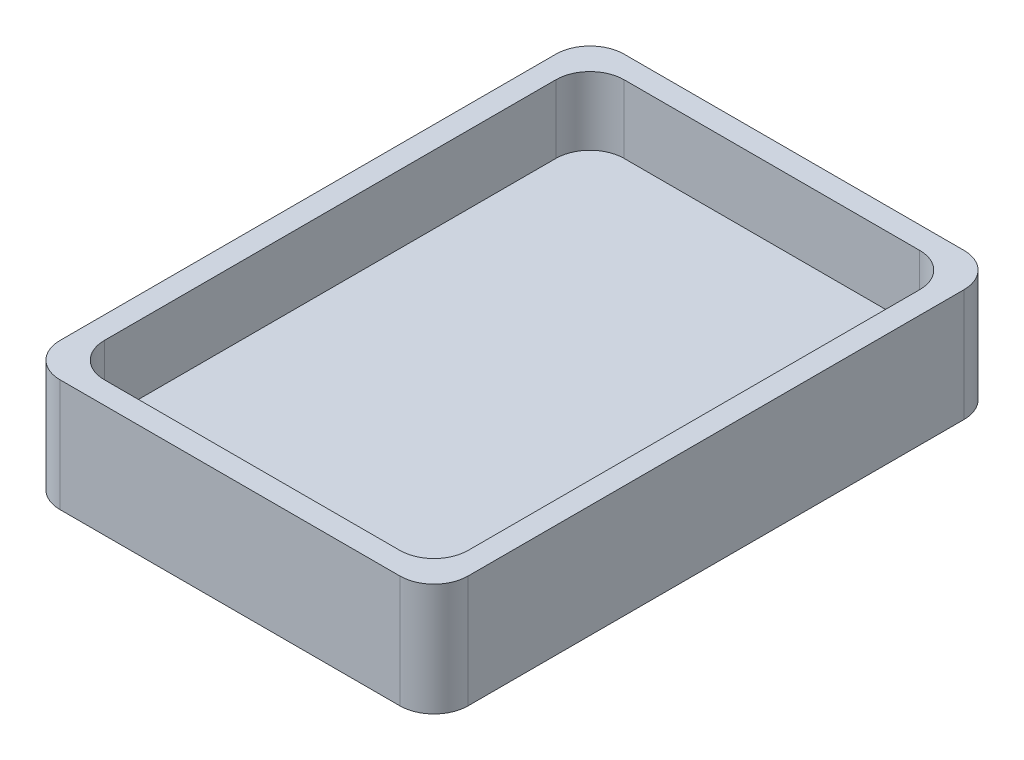
from build123d import *

# Parameters (mm, degrees)
SALIENTE_EXTRUIR1_DEPTH = 4
SALIENTE_EXTRUIR2_START = 2.6
SALIENTE_EXTRUIR2_DEPTH = 2.6
CROQUIS4_W              = 0.550354004
CROQUIS4_H              = 1.651062012
CORTAR_EXTRUIR2_DEPTH   = 1.3


with BuildPart() as part:
    # Croquis1 → Saliente-Extruir1 (new body)
    with BuildSketch(Plane(origin=(0, 0, 0), x_dir=(1, 0, 0), z_dir=(0, 1, 0))):
        with BuildLine():
            Line((-8.295775691, 15.129732152), (11.650012909, 15.129732152))
            ThreePointArc((11.650012909, 15.129732152), (13.064226472, 14.543945715), (13.650012909, 13.129732152))
            Line((13.650012909, 13.129732152), (13.650012909, -15.970267848))
            ThreePointArc((13.650012909, -15.970267848), (13.064226472, -17.38448141), (11.650012909, -17.970267848))
            Line((11.650012909, -17.970267848), (-8.295775691, -17.970267848))
            ThreePointArc((-8.295775691, -17.970267848), (-9.709989253, -17.38448141), (-10.295775691, -15.970267848))
            Line((-10.295775691, -15.970267848), (-10.295775691, 13.129732152))
            ThreePointArc((-10.295775691, 13.129732152), (-9.709989253, 14.543945715), (-8.295775691, 15.129732152))
        make_face()
        with BuildLine():
            Line((-6.995775691, 13.829732152), (10.350012909, 13.829732152))
            ThreePointArc((10.350012909, 13.829732152), (11.764226472, 13.243945715), (12.350012909, 11.829732152))
            Line((12.350012909, 11.829732152), (12.350012909, -14.670267848))
            ThreePointArc((12.350012909, -14.670267848), (11.764226472, -16.08448141), (10.350012909, -16.670267848))
            Line((10.350012909, -16.670267848), (-6.995775691, -16.670267848))
            ThreePointArc((-6.995775691, -16.670267848), (-8.409989253, -16.08448141), (-8.995775691, -14.670267848))
            Line((-8.995775691, -14.670267848), (-8.995775691, 11.829732152))
            ThreePointArc((-8.995775691, 11.829732152), (-8.409989253, 13.243945715), (-6.995775691, 13.829732152))
        make_face(mode=Mode.SUBTRACT)
    extrude(amount=SALIENTE_EXTRUIR1_DEPTH)

    # Croquis2 → Saliente-Extruir2 (add)
    with BuildSketch(Plane.XZ.offset(SALIENTE_EXTRUIR2_START)):
        with BuildLine():
            Line((-8.295775691, -15.129732152), (11.650012909, -15.129732152))
            ThreePointArc((11.650012909, -15.129732152), (13.064226472, -14.543945715), (13.650012909, -13.129732152))
            Line((13.650012909, -13.129732152), (13.650012909, 15.970267848))
            ThreePointArc((13.650012909, 15.970267848), (13.064226472, 17.38448141), (11.650012909, 17.970267848))
            Line((11.650012909, 17.970267848), (-8.295775691, 17.970267848))
            ThreePointArc((-8.295775691, 17.970267848), (-9.709989253, 17.38448141), (-10.295775691, 15.970267848))
            Line((-10.295775691, 15.970267848), (-10.295775691, -13.129732152))
            ThreePointArc((-10.295775691, -13.129732152), (-9.709989253, -14.543945715), (-8.295775691, -15.129732152))
        make_face()
    extrude(amount=-SALIENTE_EXTRUIR2_DEPTH)

    # Croquis4 → Cortar-Extruir2 (cut)
    # profile 1 of 6: a face of its own
    with BuildSketch(Plane.XZ.offset(2.6)):
        with BuildLine():
            Line((3.878534641, 9.583852239), (-0.340846056, 12.485631944))
            Line((-0.340846056, 12.485631944), (-0.340846056, 10.628187181))
            add(Edge.make_bspline(
                [(-0.340846056, 10.628187181), (-0.340293861, 10.593775491), (-0.339218325, 10.526750183), (-0.330985944, 10.429595771), (-0.315516971, 10.338925542), (-0.294432344, 10.255029258), (-0.269213104, 10.176854825), (-0.236354049, 10.10543452), (-0.197376818, 10.040848055), (-0.152224109, 9.981246937), (-0.097250421, 9.92664647), (-0.030422822, 9.875622341), (0.047331434, 9.824248611), (0.138354394, 9.776893843), (0.240158527, 9.728163886), (0.354743886, 9.68318014), (0.48134522, 9.639076545), (0.570252198, 9.612185098), (0.616540597, 9.598184375)],
                knots=[0, 0, 0, 0, 1.061955357, 2.06842165, 3.00564852, 3.8972323, 4.736458012, 5.536913666, 6.317386089, 7.060509816, 7.838937086, 8.700150504, 9.651597968, 10.711413248, 11.86339383, 13.133749289, 14.507719437, 16, 16, 16, 16], degree=3))
            Line((0.616540597, 9.598184375), (0.596475607, 9.492126572))
            Line((0.596475607, 9.492126572), (-0.524297391, 9.695642896))
            Line((-0.524297391, 9.695642896), (-0.524297391, 13.283454154))
            Line((-0.524297391, 13.283454154), (-0.441171005, 13.283454154))
            Line((-0.441171005, 13.283454154), (3.695083306, 10.439958467))
            Line((3.695083306, 10.439958467), (3.695083306, 11.83973037))
            add(Edge.make_bspline(
                [(3.695083306, 11.83973037), (3.69436279, 11.893921517), (3.693024703, 11.994561104), (3.678683069, 12.133200846), (3.657806852, 12.248677769), (3.623521604, 12.342017743), (3.579488543, 12.418106582), (3.52919239, 12.484007315), (3.46840076, 12.538876732), (3.411353317, 12.578418915), (3.358000775, 12.604289013), (3.310811044, 12.624935719), (3.255226373, 12.643296392), (3.191885132, 12.662610035), (3.120822557, 12.681436978), (3.041837671, 12.699789458), (2.955030198, 12.716562722), (2.894407357, 12.727440306), (2.86286397, 12.73310015)],
                knots=[0, 0, 0, 0, 1.853494271, 3.442165503, 4.765163255, 5.858301625, 6.82480623, 7.764392432, 8.68223785, 9.616245567, 10.127996757, 10.708984006, 11.377604019, 12.12918449, 12.975111885, 13.892439551, 14.903390307, 16, 16, 16, 16], degree=3))
            Line((2.86286397, 12.73310015), (2.86286397, 12.85540104))
            Line((2.86286397, 12.85540104), (3.878534641, 12.73310015))
            Line((3.878534641, 12.73310015), (3.878534641, 9.583852239))
        make_face()
    # profile 2 of 6: a face of its own
    with BuildSketch(Plane.XZ.offset(2.6)):
        with Locations((0.973888509, 8.238542452)):
            Rectangle(CROQUIS4_W, CROQUIS4_H)
    # profile 3 of 6: a face of its own
    with BuildSketch(Plane.XZ.offset(2.6)):
        with BuildLine():
            Line((3.939685086, 4.110887423), (2.410923964, 4.110887423))
            Line((2.410923964, 4.110887423), (2.410923964, 4.233188312))
            add(Edge.make_bspline(
                [(2.410923964, 4.233188312), (2.484959918, 4.243081359), (2.625815892, 4.261903224), (2.824537189, 4.30325674), (2.999339933, 4.356308559), (3.152761472, 4.420600115), (3.286877616, 4.498868222), (3.404728006, 4.591925382), (3.508899902, 4.698341527), (3.596406149, 4.818758967), (3.666091984, 4.947653567), (3.719236021, 5.07995903), (3.749561882, 5.215648544), (3.75401481, 5.306685612), (3.756233751, 5.352050358)],
                knots=[0, 0, 0, 0, 1.39142573, 2.647235773, 3.777217868, 4.790166756, 5.739721597, 6.660947591, 7.57997301, 8.505774658, 9.424550985, 10.303925409, 11.154827868, 12, 12, 12, 12], degree=3))
            add(Edge.make_bspline(
                [(3.756233751, 5.352050358), (3.755876154, 5.377256381), (3.755171207, 5.426946262), (3.743852355, 5.49944691), (3.727926103, 5.568995783), (3.705005658, 5.635060043), (3.675029575, 5.697767445), (3.638630472, 5.756835458), (3.596201412, 5.81327063), (3.531044553, 5.881060793), (3.442606852, 5.955121808), (3.325240573, 6.020581977), (3.199560112, 6.060927113), (3.112850553, 6.065434845), (3.069246722, 6.067701659)],
                knots=[0, 0, 0, 0, 0.823190787, 1.622796809, 2.393120433, 3.153812862, 3.903666924, 4.660859271, 5.418910275, 6.207043985, 7.730921109, 9.171105095, 10.577427236, 12, 12, 12, 12], degree=3))
            add(Edge.make_bspline(
                [(3.069246722, 6.067701659), (3.03562727, 6.066424365), (2.969408893, 6.063908551), (2.872974217, 6.037895325), (2.780030324, 5.999843847), (2.724651647, 5.961164018), (2.696611198, 5.941578866)],
                knots=[0, 0, 0, 0, 1.005601748, 1.980678245, 2.977536257, 4, 4, 4, 4], degree=3))
            add(Edge.make_bspline(
                [(2.696611198, 5.941578866), (2.674949824, 5.924104807), (2.627853588, 5.886112644), (2.558842003, 5.816135937), (2.482988493, 5.73239534), (2.404480408, 5.631020249), (2.319104685, 5.515277061), (2.228829412, 5.383524134), (2.133241174, 5.236342677), (2.069561828, 5.132133778), (2.036377489, 5.077828832)],
                knots=[0, 0, 0, 0, 0.611101905, 1.328659962, 2.156268474, 3.09294578, 4.144138902, 5.3166236, 6.60164907, 8, 8, 8, 8], degree=3))
            add(Edge.make_bspline(
                [(2.036377489, 5.077828832), (2.00935476, 5.033210067), (1.957147302, 4.947007362), (1.880937874, 4.822968178), (1.809428189, 4.709157688), (1.742172424, 4.606088553), (1.681146875, 4.512161261), (1.625146353, 4.42812719), (1.573459392, 4.354820656), (1.513095561, 4.270810814), (1.437669316, 4.178184385), (1.338037022, 4.081686712), (1.230819956, 3.998195288), (1.116458907, 3.928422776), (0.996705068, 3.873766429), (0.873578266, 3.834453378), (0.747512665, 3.809231844), (0.662201826, 3.806503718), (0.619407024, 3.805135198)],
                knots=[0, 0, 0, 0, 1.248564963, 2.412206562, 3.484516376, 4.465640353, 5.357921181, 6.165592113, 6.882544305, 7.504670364, 8.641790332, 9.736174339, 10.817308786, 11.888072917, 12.935378102, 13.959992044, 14.976663013, 16, 16, 16, 16], degree=3))
            add(Edge.make_bspline(
                [(0.619407024, 3.805135198), (0.578884567, 3.806112801), (0.499009673, 3.808039779), (0.381836812, 3.827030806), (0.269115063, 3.856644683), (0.160598597, 3.898088985), (0.055658703, 3.950845439), (-0.044653033, 4.016225865), (-0.140855623, 4.093127548), (-0.230951403, 4.181627739), (-0.313235316, 4.279345991), (-0.387021406, 4.383907746), (-0.447900021, 4.496498995), (-0.498774486, 4.615051679), (-0.538305506, 4.740487163), (-0.565690993, 4.87268847), (-0.582075735, 5.011806822), (-0.58430851, 5.10676681), (-0.585447835, 5.155222364)],
                knots=[0, 0, 0, 0, 0.963147794, 1.898486258, 2.815390311, 3.731292419, 4.656172952, 5.603823843, 6.573947296, 7.581047086, 8.602405402, 9.609020728, 10.619278069, 11.640833019, 12.673450854, 13.741688496, 14.847643762, 16, 16, 16, 16], degree=3))
            add(Edge.make_bspline(
                [(-0.585447835, 5.155222364), (-0.584142722, 5.215520271), (-0.581600209, 5.332987594), (-0.564907589, 5.449282921), (-0.556783564, 5.505881946)],
                knots=[0, 0, 0, 0, 1.026632861, 2, 2, 2, 2], degree=3))
            add(Edge.make_bspline(
                [(-0.556783564, 5.505881946), (-0.554890775, 5.515121844), (-0.55064092, 5.535868072), (-0.543096173, 5.570371111), (-0.53244132, 5.611439471), (-0.51896141, 5.65878023), (-0.503584422, 5.712990628), (-0.48566664, 5.773581554), (-0.464405836, 5.840714885), (-0.441260938, 5.911986941), (-0.417622817, 5.983008543), (-0.397963493, 6.049805707), (-0.3805685, 6.109306402), (-0.366019368, 6.161415132), (-0.355482514, 6.206744631), (-0.347750656, 6.244959732), (-0.342598065, 6.276188335), (-0.341372056, 6.29477455), (-0.340846056, 6.302748681)],
                knots=[0, 0, 0, 0, 0.54761179, 1.229545953, 2.05028691, 3.010423316, 4.087386644, 5.321895787, 6.678726042, 8.175741249, 9.672756456, 11.024157601, 12.217972098, 13.272151859, 14.164739674, 14.919049308, 15.53623463, 16, 16, 16, 16], degree=3))
            add(Edge.make_bspline(
                [(-0.340846056, 6.302748681), (-0.341364831, 6.31521463), (-0.342362902, 6.339197893), (-0.350920822, 6.373571603), (-0.366478278, 6.403459572), (-0.38853237, 6.430321693), (-0.421445999, 6.451274059), (-0.464523333, 6.470941767), (-0.520951626, 6.484832166), (-0.562793108, 6.491918134), (-0.585447835, 6.495754773)],
                knots=[0, 0, 0, 0, 0.858084681, 1.650870771, 2.416167262, 3.163326943, 4.015220049, 5.07550074, 6.416553863, 8, 8, 8, 8], degree=3))
            Line((-0.585447835, 6.495754773), (-0.585447835, 6.618055663))
            Line((-0.585447835, 6.618055663), (0.943313287, 6.618055663))
            Line((0.943313287, 6.618055663), (0.943313287, 6.495754773))
            add(Edge.make_bspline(
                [(0.943313287, 6.495754773), (0.902174275, 6.489036114), (0.822563997, 6.476034481), (0.707752334, 6.452436739), (0.600603173, 6.429595375), (0.502156825, 6.402097011), (0.411067276, 6.374903579), (0.327839387, 6.345246186), (0.252325489, 6.314147882), (0.16308934, 6.269479761), (0.060122966, 6.204648428), (-0.050853832, 6.108327553), (-0.151028826, 5.993980349), (-0.238987986, 5.864221218), (-0.311440852, 5.722258576), (-0.36333449, 5.571107353), (-0.396206202, 5.413343982), (-0.400051012, 5.305393359), (-0.401996501, 5.250769934)],
                knots=[0, 0, 0, 0, 0.984182084, 1.904542815, 2.767594021, 3.570341986, 4.31735939, 5.011959232, 5.655849932, 6.244440382, 7.36692079, 8.518747489, 9.701680121, 10.946991771, 12.211638285, 13.453174393, 14.711296577, 16, 16, 16, 16], degree=3))
            add(Edge.make_bspline(
                [(-0.401996501, 5.250769934), (-0.401115433, 5.219539095), (-0.39939413, 5.158524784), (-0.390258273, 5.069222978), (-0.372902146, 4.98483715), (-0.348960659, 4.905648845), (-0.319575809, 4.83093368), (-0.281809061, 4.762041745), (-0.238063448, 4.697633271), (-0.187058951, 4.639642668), (-0.132365422, 4.587462284), (-0.074074557, 4.542321663), (-0.014531713, 4.502247472), (0.049528858, 4.47246643), (0.114273366, 4.446752681), (0.182078259, 4.429847218), (0.252149723, 4.41893282), (0.299917676, 4.417411752), (0.324165032, 4.416639647)],
                knots=[0, 0, 0, 0, 1.212040469, 2.367909939, 3.477883232, 4.549069953, 5.57481445, 6.586694365, 7.591000223, 8.589587838, 9.577335541, 10.519182355, 11.448049943, 12.354451666, 13.254089103, 14.147253018, 15.05953235, 16, 16, 16, 16], degree=3))
            add(Edge.make_bspline(
                [(0.324165032, 4.416639647), (0.351653848, 4.417372182), (0.40711616, 4.418850167), (0.489721652, 4.437088535), (0.573578134, 4.460935061), (0.656565057, 4.498135129), (0.739103101, 4.544618979), (0.818253395, 4.603417474), (0.894684267, 4.67297543), (0.941257663, 4.725740609), (0.965289228, 4.752967094)],
                knots=[0, 0, 0, 0, 0.880861666, 1.777254614, 2.705733056, 3.676491508, 4.688590632, 5.741847226, 6.83480806, 8, 8, 8, 8], degree=3))
            add(Edge.make_bspline(
                [(0.965289228, 4.752967094), (0.974633287, 4.764670194), (0.996223579, 4.791711265), (1.03013989, 4.840100183), (1.072436936, 4.899686709), (1.119780712, 4.97282841), (1.174635686, 5.05793617), (1.235081148, 5.156161193), (1.303327314, 5.266107549), (1.375686787, 5.385577244), (1.449954453, 5.506884723), (1.521507571, 5.624237972), (1.590393866, 5.73238939), (1.654279059, 5.833532982), (1.715402708, 5.925505188), (1.771875313, 6.010056336), (1.82419005, 6.086349596), (1.888147767, 6.176106813), (1.968236797, 6.275979636), (2.067712554, 6.383541273), (2.175241591, 6.472619863), (2.285995346, 6.548055882), (2.402839638, 6.607692302), (2.526007878, 6.648266488), (2.654438962, 6.674299699), (2.742029348, 6.677555735), (2.786425914, 6.679206107)],
                knots=[0, 0, 0, 0, 0.389670496, 0.900368887, 1.537327681, 2.291397621, 3.167445765, 4.172602766, 5.292873819, 6.535337192, 7.807662738, 8.994725359, 10.112356069, 11.144792405, 12.10806384, 12.986266124, 13.790981069, 14.515592038, 15.854128484, 17.120635582, 18.320965422, 19.479645839, 20.602856919, 21.722115554, 22.845418386, 24, 24, 24, 24], degree=3))
            add(Edge.make_bspline(
                [(2.786425914, 6.679206107), (2.825019685, 6.678051674), (2.901276992, 6.675770633), (3.013718812, 6.659198867), (3.122119336, 6.631725929), (3.225905884, 6.591832869), (3.326095683, 6.542129815), (3.421659244, 6.480274414), (3.51402447, 6.408624162), (3.600060949, 6.32541455), (3.680143293, 6.235126412), (3.748963043, 6.136506086), (3.808923839, 6.03341746), (3.856822466, 5.923328049), (3.894130856, 5.807125579), (3.920841239, 5.684934176), (3.936075886, 5.556587754), (3.9384641, 5.469295229), (3.939685086, 5.424666512)],
                knots=[0, 0, 0, 0, 0.975062147, 1.926622126, 2.865572658, 3.795337113, 4.731177957, 5.686745952, 6.667240611, 7.680517841, 8.707195514, 9.712063125, 10.714348853, 11.716246724, 12.739448301, 13.794013663, 14.87217904, 16, 16, 16, 16], degree=3))
            add(Edge.make_bspline(
                [(3.939685086, 5.424666512), (3.937476016, 5.366899243), (3.932955737, 5.248693743), (3.900992509, 5.069186254), (3.848169202, 4.884973025), (3.798802356, 4.763696464), (3.773432314, 4.701371406)],
                knots=[0, 0, 0, 0, 0.927627064, 1.898144454, 2.919838524, 4, 4, 4, 4], degree=3))
            add(Edge.make_bspline(
                [(3.773432314, 4.701371406), (3.761517069, 4.67414401), (3.739861044, 4.624658061), (3.716454323, 4.555122416), (3.698888716, 4.499328244), (3.696219196, 4.465451457), (3.695083306, 4.451036772)],
                knots=[0, 0, 0, 0, 1.351879575, 2.457048934, 3.343469241, 4, 4, 4, 4], degree=3))
            add(Edge.make_bspline(
                [(3.695083306, 4.451036772), (3.6954817, 4.437902048), (3.696251526, 4.412521485), (3.706577594, 4.376398231), (3.721482197, 4.343720601), (3.743736585, 4.314091849), (3.776072054, 4.288493373), (3.819914819, 4.267303094), (3.875485308, 4.248207049), (3.91695718, 4.238505222), (3.939685086, 4.233188312)],
                knots=[0, 0, 0, 0, 0.868125657, 1.677501313, 2.471018957, 3.239701785, 4.110392073, 5.177601582, 6.453235832, 8, 8, 8, 8], degree=3))
            Line((3.939685086, 4.233188312), (3.939685086, 4.110887423))
        make_face()
    # profile 4 of 6: a face of its own
    with BuildSketch(Plane.XZ.offset(2.6)):
        with BuildLine():
            Line((3.939685086, -0.414245499), (2.410923964, -0.536546388))
            Line((2.410923964, -0.536546388), (2.410923964, -0.414245499))
            add(Edge.make_bspline(
                [(2.410923964, -0.414245499), (2.468764721, -0.397988664), (2.580822781, -0.36649341), (2.741013305, -0.310345001), (2.889311765, -0.251135503), (3.024438009, -0.184836025), (3.147214323, -0.114251617), (3.257973542, -0.03884814), (3.355752546, 0.042558), (3.441541922, 0.128952114), (3.515486925, 0.220616004), (3.579946019, 0.316449787), (3.634328144, 0.417043693), (3.679823682, 0.521665485), (3.714447508, 0.631187032), (3.73745518, 0.745298362), (3.753968391, 0.863385747), (3.755470565, 0.9437444), (3.756233751, 0.984570928)],
                knots=[0, 0, 0, 0, 1.365115603, 2.644713018, 3.855757171, 4.991985138, 6.062154657, 7.072025556, 8.033065275, 8.949227346, 9.834355564, 10.705613414, 11.570382876, 12.429560572, 13.294875113, 14.175017322, 15.072810392, 16, 16, 16, 16], degree=3))
            add(Edge.make_bspline(
                [(3.756233751, 0.984570928), (3.755334103, 1.018983032), (3.753556441, 1.086979709), (3.744405545, 1.187695725), (3.726638163, 1.28558387), (3.703378168, 1.38136876), (3.67088263, 1.474096391), (3.634345735, 1.565377838), (3.58888328, 1.653203151), (3.537273794, 1.738737269), (3.478188907, 1.820816076), (3.411057276, 1.898873244), (3.334763901, 1.971109702), (3.251936801, 2.041073748), (3.158154309, 2.102649649), (3.059273844, 2.16419785), (2.950223082, 2.21786987), (2.834180796, 2.26884287), (2.709859882, 2.313319223), (2.578491064, 2.352684319), (2.439987736, 2.385771608), (2.294060626, 2.413830618), (2.140615264, 2.434613793), (1.979545485, 2.448186684), (1.811656486, 2.458603501), (1.697200966, 2.459413045), (1.638899597, 2.459825411)],
                knots=[0, 0, 0, 0, 0.852513238, 1.684525486, 2.501557535, 3.314657944, 4.122884273, 4.932956222, 5.747891211, 6.569063427, 7.405364907, 8.249848014, 9.114572468, 10.005384121, 10.930865783, 11.890024271, 12.888376645, 13.937630198, 15.028062455, 16.156107303, 17.332750309, 18.553388997, 19.83519646, 21.165691355, 22.556259468, 24, 24, 24, 24], degree=3))
            add(Edge.make_bspline(
                [(1.638899597, 2.459825411), (1.590476756, 2.459286198), (1.495145379, 2.458224636), (1.354857646, 2.44952696), (1.219396505, 2.435056875), (1.088765283, 2.415714208), (0.963420253, 2.38813782), (0.842451903, 2.357435295), (0.72703362, 2.318562437), (0.616059476, 2.276000014), (0.510545292, 2.227707563), (0.412308894, 2.17149506), (0.318772494, 2.111908201), (0.232788942, 2.044303938), (0.152302509, 1.971859094), (0.078087239, 1.893211262), (0.011726306, 1.807733381), (-0.049794965, 1.718063807), (-0.103900792, 1.623728374), (-0.151226876, 1.525835321), (-0.190044262, 1.424293075), (-0.222780551, 1.319665587), (-0.248642402, 1.211817335), (-0.266807211, 1.100375579), (-0.27728632, 0.985728968), (-0.278886902, 0.908153886), (-0.279695611, 0.868958368)],
                knots=[0, 0, 0, 0, 1.236790571, 2.434903576, 3.588438759, 4.71597806, 5.805760329, 6.86536762, 7.902118444, 8.914321191, 9.900694802, 10.862335501, 11.803279121, 12.730834146, 13.652376248, 14.567468251, 15.488615281, 16.413741212, 17.343078284, 18.263650361, 19.188239602, 20.117113671, 21.062267979, 22.018525546, 22.998841947, 24, 24, 24, 24], degree=3))
            add(Edge.make_bspline(
                [(-0.279695611, 0.868958368), (-0.277867835, 0.80193334), (-0.274293898, 0.67087613), (-0.240785323, 0.480601484), (-0.187559922, 0.302170396), (-0.1239968, 0.162109606), (-0.058621005, 0.055267205), (-0.000125909, -0.027553682), (0.070164389, -0.11125311), (0.150563251, -0.197344009), (0.241988161, -0.285062478), (0.342867041, -0.376191454), (0.455943931, -0.4672585), (0.535485887, -0.527518342), (0.576410617, -0.558522329)],
                knots=[0, 0, 0, 0, 1.384369864, 2.706923932, 3.979392615, 5.225429667, 5.872362172, 6.566477539, 7.319183729, 8.12964106, 9.000244434, 9.937306366, 10.938733914, 12, 12, 12, 12], degree=3))
            Line((0.576410617, -0.558522329), (0.515260172, -0.658847278))
            add(Edge.make_bspline(
                [(0.515260172, -0.658847278), (0.469109802, -0.631925234), (0.378315845, -0.578960136), (0.249780111, -0.493124515), (0.130826837, -0.404090464), (0.021376262, -0.311942807), (-0.079365071, -0.216996641), (-0.169014827, -0.116788612), (-0.250803339, -0.01510404), (-0.322053074, 0.091199316), (-0.384440229, 0.201352864), (-0.438088497, 0.316816477), (-0.483802654, 0.436851345), (-0.521479323, 0.561958683), (-0.549761657, 0.692388915), (-0.570765513, 0.827637384), (-0.583565995, 0.968079706), (-0.584812935, 1.063211328), (-0.585447835, 1.111649196)],
                knots=[0, 0, 0, 0, 1.164208467, 2.290406175, 3.366281995, 4.400767194, 5.407231672, 6.380278692, 7.328804444, 8.249021907, 9.16593498, 10.085104718, 11.021000282, 11.96307869, 12.929767156, 13.927167342, 14.944582323, 16, 16, 16, 16], degree=3))
            add(Edge.make_bspline(
                [(-0.585447835, 1.111649196), (-0.585003173, 1.155302534), (-0.584125716, 1.241444095), (-0.573990682, 1.368649882), (-0.558992206, 1.492442444), (-0.537429079, 1.612536756), (-0.507723876, 1.728521341), (-0.47564764, 1.841567268), (-0.433369914, 1.949778718), (-0.387212171, 2.054730667), (-0.334068152, 2.155824176), (-0.275015105, 2.253361555), (-0.208839313, 2.346895794), (-0.137046738, 2.436844337), (-0.05952887, 2.5233341), (0.025196792, 2.605446011), (0.115231196, 2.684943732), (0.179869184, 2.733510529), (0.212374375, 2.75793383)],
                knots=[0, 0, 0, 0, 1.099867591, 2.170379506, 3.21370673, 4.241732154, 5.242319988, 6.230208013, 7.200627964, 8.167156574, 9.118536317, 10.076596279, 11.038581839, 12.003776478, 12.975622664, 13.963217193, 14.975741399, 16, 16, 16, 16], degree=3))
            add(Edge.make_bspline(
                [(0.212374375, 2.75793383), (0.262481156, 2.792834876), (0.362107402, 2.862227884), (0.520825937, 2.951568546), (0.686480345, 3.025730665), (0.858551204, 3.087539199), (1.037309935, 3.134915784), (1.222476281, 3.169599568), (1.414226138, 3.189855693), (1.544259849, 3.192360089), (1.610235326, 3.193630749)],
                knots=[0, 0, 0, 0, 0.983430026, 1.955332979, 2.929117015, 3.904576077, 4.897850039, 5.905285016, 6.937200057, 8, 8, 8, 8], degree=3))
            add(Edge.make_bspline(
                [(1.610235326, 3.193630749), (1.663756597, 3.192525053), (1.769665517, 3.19033708), (1.927153438, 3.178561545), (2.080661647, 3.154662045), (2.231570815, 3.124905743), (2.378543796, 3.083785359), (2.52352346, 3.037129895), (2.663559279, 2.977856723), (2.800301184, 2.912307608), (2.9315571, 2.839096343), (3.056461915, 2.758920345), (3.17270499, 2.670653276), (3.282286421, 2.576983138), (3.383783447, 2.476347578), (3.477680673, 2.36908394), (3.563841631, 2.255062477), (3.642045534, 2.134990995), (3.711114193, 2.010081153), (3.773183974, 1.882617954), (3.824584715, 1.751544487), (3.866786303, 1.617473717), (3.899307813, 1.48078905), (3.922000957, 1.341229388), (3.937043699, 1.198926146), (3.938800106, 1.102769812), (3.939685086, 1.054320654)],
                knots=[0, 0, 0, 0, 1.092255407, 2.161375962, 3.219218475, 4.260482765, 5.297825753, 6.331518591, 7.365803668, 8.397635892, 9.42460652, 10.430448635, 11.423444652, 12.400404878, 13.370010219, 14.3371515, 15.30675684, 16.283717067, 17.258296836, 18.217479776, 19.174458709, 20.128144221, 21.083356286, 22.038479922, 23.011672017, 24, 24, 24, 24], degree=3))
            add(Edge.make_bspline(
                [(3.939685086, 1.054320654), (3.937593495, 0.978368292), (3.933405219, 0.826278554), (3.895681448, 0.59955263), (3.838825489, 0.373618787), (3.781433609, 0.227932678), (3.752411848, 0.154262544)],
                knots=[0, 0, 0, 0, 0.984376883, 1.971151638, 2.974057776, 4, 4, 4, 4], degree=3))
            add(Edge.make_bspline(
                [(3.752411848, 0.154262544), (3.743961977, 0.13426371), (3.7285316, 0.097743681), (3.709786048, 0.047012154), (3.698436839, 0.005046445), (3.696091945, -0.020228085), (3.695083306, -0.031099742)],
                knots=[0, 0, 0, 0, 1.336058692, 2.439787325, 3.328885714, 4, 4, 4, 4], degree=3))
            add(Edge.make_bspline(
                [(3.695083306, -0.031099742), (3.697049729, -0.057960147), (3.70093478, -0.111028109), (3.73027728, -0.155382939), (3.744768043, -0.177287525)],
                knots=[0, 0, 0, 0, 1.012302122, 2, 2, 2, 2], degree=3))
            add(Edge.make_bspline(
                [(3.744768043, -0.177287525), (3.757073973, -0.190214124), (3.782210874, -0.216618843), (3.828948551, -0.247319628), (3.88128325, -0.274147449), (3.919700215, -0.285854493), (3.939685086, -0.291944609)],
                knots=[0, 0, 0, 0, 0.931295945, 1.90232619, 2.908770141, 4, 4, 4, 4], degree=3))
            Line((3.939685086, -0.291944609), (3.939685086, -0.414245499))
        make_face()
    # profile 5 of 6: a face of its own
    with BuildSketch(Plane.XZ.offset(2.6)):
        with BuildLine():
            Line((0.943313287, -4.019255319), (0.943313287, -2.265001932))
            Line((0.943313287, -2.265001932), (0.249637927, -1.94300662))
            add(Edge.make_bspline(
                [(0.249637927, -1.94300662), (0.210333032, -1.926561766), (0.137840114, -1.896231309), (0.035176342, -1.861710708), (-0.05156366, -1.83813124), (-0.10505627, -1.834662203), (-0.12873045, -1.833126915)],
                knots=[0, 0, 0, 0, 1.290094603, 2.37941668, 3.282779777, 4, 4, 4, 4], degree=3))
            add(Edge.make_bspline(
                [(-0.12873045, -1.833126915), (-0.145179199, -1.834081342), (-0.177866389, -1.835977995), (-0.224315811, -1.856290353), (-0.268093459, -1.886121522), (-0.300123027, -1.921500955), (-0.324597972, -1.956520038), (-0.34016843, -1.99133229), (-0.35448958, -2.032575028), (-0.366493604, -2.08066353), (-0.37792442, -2.135479709), (-0.388753526, -2.197199769), (-0.395682578, -2.266215399), (-0.399829317, -2.31436494), (-0.401996501, -2.339529036)],
                knots=[0, 0, 0, 0, 0.928585293, 1.845298099, 2.833422532, 3.920951893, 4.532836432, 5.252751675, 6.076265914, 7.010468409, 8.063784373, 9.255881379, 10.565858316, 12, 12, 12, 12], degree=3))
            Line((-0.401996501, -2.339529036), (-0.524297391, -2.339529036))
            Line((-0.524297391, -2.339529036), (-0.524297391, -0.956955697))
            Line((-0.524297391, -0.956955697), (-0.401996501, -0.956955697))
            add(Edge.make_bspline(
                [(-0.401996501, -0.956955697), (-0.393408558, -0.998849068), (-0.377794678, -1.075016096), (-0.347786863, -1.176396778), (-0.314497249, -1.255171673), (-0.283598234, -1.294366671), (-0.270140854, -1.311437182)],
                knots=[0, 0, 0, 0, 1.341417684, 2.438853554, 3.320077337, 4, 4, 4, 4], degree=3))
            add(Edge.make_bspline(
                [(-0.270140854, -1.311437182), (-0.255078209, -1.325708027), (-0.223034208, -1.356067568), (-0.166712906, -1.399180882), (-0.099685023, -1.44271786), (-0.02230028, -1.487293075), (0.065425938, -1.533336008), (0.163087454, -1.58086343), (0.272026831, -1.628660755), (0.348303299, -1.660029039), (0.388181904, -1.6764289)],
                knots=[0, 0, 0, 0, 0.657509844, 1.398774721, 2.244567789, 3.190193186, 4.229071695, 5.385194885, 6.63293641, 8, 8, 8, 8], degree=3))
            Line((0.388181904, -1.6764289), (3.939685086, -3.327490912))
            Line((3.939685086, -3.327490912), (3.939685086, -3.446925374))
            Line((3.939685086, -3.446925374), (0.310788372, -4.93937842))
            add(Edge.make_bspline(
                [(0.310788372, -4.93937842), (0.275928976, -4.954029412), (0.208885886, -4.98220683), (0.114591185, -5.027889973), (0.028554784, -5.06994977), (-0.047228899, -5.112231605), (-0.11341202, -5.153120908), (-0.170047279, -5.193148749), (-0.21736128, -5.232133061), (-0.267572582, -5.283493134), (-0.318372251, -5.35490134), (-0.360514623, -5.454529169), (-0.390811778, -5.567438007), (-0.398153331, -5.648137562), (-0.401996501, -5.690382321)],
                knots=[0, 0, 0, 0, 1.223989839, 2.354029848, 3.391605643, 4.324042249, 5.162387765, 5.909171864, 6.567979791, 7.144041755, 8.231258465, 9.380841669, 10.628917946, 12, 12, 12, 12], degree=3))
            Line((-0.401996501, -5.690382321), (-0.524297391, -5.690382321))
            Line((-0.524297391, -5.690382321), (-0.524297391, -3.95237202))
            Line((-0.524297391, -3.95237202), (-0.401996501, -3.95237202))
            add(Edge.make_bspline(
                [(-0.401996501, -3.95237202), (-0.399460229, -3.992629334), (-0.394819933, -4.066283033), (-0.375113124, -4.165659364), (-0.351802991, -4.245743381), (-0.316065818, -4.305043171), (-0.274173835, -4.346844113), (-0.228546598, -4.376167359), (-0.178470091, -4.394483892), (-0.143531694, -4.396569198), (-0.125864023, -4.397623697)],
                knots=[0, 0, 0, 0, 1.654906515, 3.02777245, 4.157359627, 5.061699779, 5.83887417, 6.568440116, 7.276087863, 8, 8, 8, 8], degree=3))
            add(Edge.make_bspline(
                [(-0.125864023, -4.397623697), (-0.097710291, -4.395906938), (-0.03354321, -4.391994155), (0.071727232, -4.363448262), (0.19865406, -4.324158635), (0.288736102, -4.288145856), (0.337541692, -4.268634477)],
                knots=[0, 0, 0, 0, 0.698820548, 1.592729354, 2.695763756, 4, 4, 4, 4], degree=3))
            Line((0.337541692, -4.268634477), (0.943313287, -4.019255319))
        make_face()
        Polygon((1.126764621, -3.943772739), (2.894394668, -3.19659074), (1.126764621, -2.350039269), align=None, mode=Mode.SUBTRACT)
    # profile 6 of 6: a face of its own
    with BuildSketch(Plane.XZ.offset(2.6)):
        with BuildLine():
            Line((3.878534641, -5.607255935), (3.878534641, -6.733761786))
            Line((3.878534641, -6.733761786), (0.558256579, -9.525661785))
            Line((0.558256579, -9.525661785), (3.083578857, -9.525661785))
            add(Edge.make_bspline(
                [(3.083578857, -9.525661785), (3.117348987, -9.525702467), (3.181425341, -9.525779656), (3.272518352, -9.520365314), (3.353862101, -9.514246657), (3.425360607, -9.504955099), (3.487084516, -9.492753208), (3.538690104, -9.477837638), (3.581109247, -9.460359179), (3.603583589, -9.444197944), (3.613867871, -9.436802545)],
                knots=[0, 0, 0, 0, 1.486776415, 2.821049613, 4.017258766, 5.078485589, 5.994452933, 6.784380121, 7.443731031, 8, 8, 8, 8], degree=3))
            add(Edge.make_bspline(
                [(3.613867871, -9.436802545), (3.635894705, -9.41521136), (3.680952424, -9.371044794), (3.725206344, -9.282319316), (3.752481815, -9.17856393), (3.754931827, -9.103862814), (3.756233751, -9.064167022)],
                knots=[0, 0, 0, 0, 0.893634595, 1.828003868, 2.845812335, 4, 4, 4, 4], degree=3))
            Line((3.756233751, -9.064167022), (3.756233751, -8.914157337))
            Line((3.756233751, -8.914157337), (3.878534641, -8.914157337))
            Line((3.878534641, -8.914157337), (3.878534641, -10.442918459))
            Line((3.878534641, -10.442918459), (3.756233751, -10.442918459))
            Line((3.756233751, -10.442918459), (3.756233751, -10.290042346))
            add(Edge.make_bspline(
                [(3.756233751, -10.290042346), (3.755753211, -10.268029067), (3.754822994, -10.225416234), (3.745710185, -10.164086179), (3.733060781, -10.107425404), (3.713377983, -10.055868015), (3.68892715, -10.008924712), (3.658046239, -9.96724252), (3.620990324, -9.931552852), (3.593410527, -9.911366576), (3.579470746, -9.901163736)],
                knots=[0, 0, 0, 0, 1.182386838, 2.288838982, 3.326958154, 4.296765023, 5.246416275, 6.164047556, 7.072046332, 8, 8, 8, 8], degree=3))
            add(Edge.make_bspline(
                [(3.579470746, -9.901163736), (3.569091472, -9.89546853), (3.546242389, -9.882931023), (3.505619475, -9.869056246), (3.456144785, -9.858236401), (3.398558039, -9.847513937), (3.331839168, -9.840003642), (3.256862487, -9.836094831), (3.173126605, -9.831484747), (3.114480759, -9.83143842), (3.083578857, -9.83141401)],
                knots=[0, 0, 0, 0, 0.561580455, 1.236271222, 2.028879402, 2.966584022, 4.017422664, 5.2149421, 6.532486222, 8, 8, 8, 8], degree=3))
            Line((3.083578857, -9.83141401), (-0.595002592, -9.83141401))
            Line((-0.595002592, -9.83141401), (-0.595002592, -9.706246693))
            Line((-0.595002592, -9.706246693), (2.902038474, -6.773891766))
            Line((2.902038474, -6.773891766), (0.270658393, -6.773891766))
            add(Edge.make_bspline(
                [(0.270658393, -6.773891766), (0.236889763, -6.773863569), (0.172816255, -6.773810068), (0.081704226, -6.779066124), (0.000461599, -6.7856912), (-0.071187732, -6.79339118), (-0.132874947, -6.805811945), (-0.184228454, -6.820994358), (-0.226774622, -6.837274551), (-0.249336573, -6.852800676), (-0.259630621, -6.859884579)],
                knots=[0, 0, 0, 0, 1.489562092, 2.826335232, 4.024785645, 5.086235066, 6.003918599, 6.795325823, 7.450358981, 8, 8, 8, 8], degree=3))
            add(Edge.make_bspline(
                [(-0.259630621, -6.859884579), (-0.281630779, -6.881820587), (-0.326458458, -6.926517556), (-0.371013295, -7.015283772), (-0.398151404, -7.118780115), (-0.400665544, -7.193149688), (-0.401996501, -7.232520102)],
                knots=[0, 0, 0, 0, 0.90104214, 1.835969978, 2.854386889, 4, 4, 4, 4], degree=3))
            Line((-0.401996501, -7.232520102), (-0.401996501, -7.385396215))
            Line((-0.401996501, -7.385396215), (-0.524297391, -7.385396215))
            Line((-0.524297391, -7.385396215), (-0.524297391, -5.856635093))
            Line((-0.524297391, -5.856635093), (-0.401996501, -5.856635093))
            Line((-0.401996501, -5.856635093), (-0.401996501, -6.006644778))
            add(Edge.make_bspline(
                [(-0.401996501, -6.006644778), (-0.401538674, -6.028979671), (-0.400658531, -6.071917049), (-0.391334388, -6.133841046), (-0.37899801, -6.190899761), (-0.359111825, -6.24271264), (-0.334743783, -6.289724782), (-0.303494047, -6.331353975), (-0.267092732, -6.368028595), (-0.239226435, -6.388240498), (-0.225233496, -6.398389815)],
                knots=[0, 0, 0, 0, 1.192663738, 2.292818382, 3.341598875, 4.305885976, 5.250132179, 6.162540657, 7.077327887, 8, 8, 8, 8], degree=3))
            add(Edge.make_bspline(
                [(-0.225233496, -6.398389815), (-0.214854222, -6.404085021), (-0.192005139, -6.416622529), (-0.151382225, -6.430497306), (-0.101907535, -6.44131715), (-0.044320789, -6.452039614), (0.022398082, -6.45954991), (0.097374763, -6.46345872), (0.181110645, -6.468068805), (0.239756491, -6.468115131), (0.270658393, -6.468139541)],
                knots=[0, 0, 0, 0, 0.561580455, 1.236271222, 2.028879402, 2.966584022, 4.017422664, 5.2149421, 6.532486222, 8, 8, 8, 8], degree=3))
            Line((0.270658393, -6.468139541), (3.267030192, -6.468139541))
            add(Edge.make_bspline(
                [(3.267030192, -6.468139541), (3.303826194, -6.438411802), (3.371175111, -6.384000157), (3.461069523, -6.306592862), (3.529738802, -6.240346288), (3.582658892, -6.182221494), (3.621840438, -6.122179552), (3.658479103, -6.055552214), (3.693429759, -5.977516815), (3.713938952, -5.920799754), (3.724703053, -5.891032218)],
                knots=[0, 0, 0, 0, 1.511570839, 2.766677154, 3.788633456, 4.560268711, 5.271561149, 6.073214848, 6.988740839, 8, 8, 8, 8], degree=3))
            add(Edge.make_bspline(
                [(3.724703053, -5.891032218), (3.729463754, -5.873584046), (3.740002668, -5.834958472), (3.750048969, -5.769694978), (3.755243559, -5.692382703), (3.755889115, -5.636884289), (3.756233751, -5.607255935)],
                knots=[0, 0, 0, 0, 0.757017748, 1.675834294, 2.759222096, 4, 4, 4, 4], degree=3))
            Line((3.756233751, -5.607255935), (3.878534641, -5.607255935))
        make_face()
    extrude(amount=-CORTAR_EXTRUIR2_DEPTH, mode=Mode.SUBTRACT)


solid = part.part
